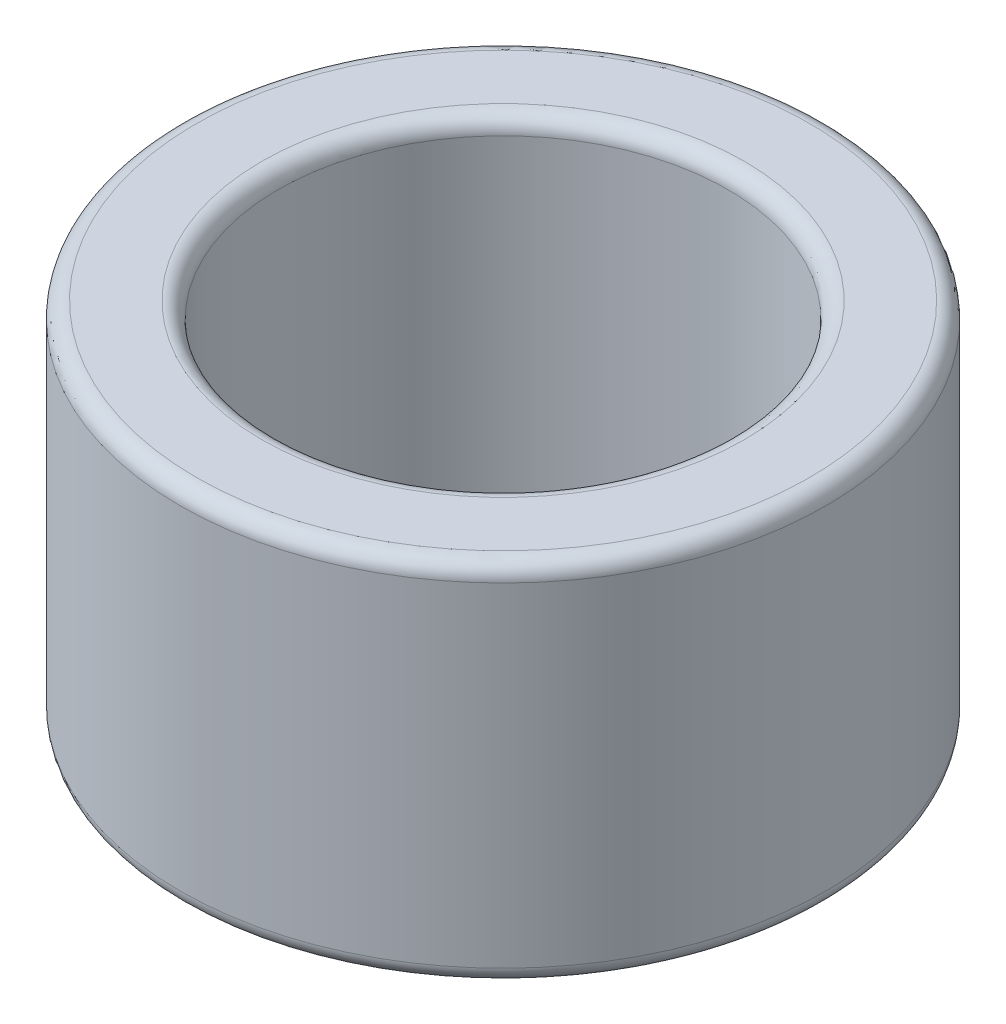
from build123d import *

# Parameters (mm, degrees)
SKETCH1_R                = 3.95
BOSS_EXTRUDE1_DEPTH      = 4.48
M5_CLEARANCE_HOLE1_D     = 5.5
M5_CLEARANCE_HOLE1_DEPTH = 4.48
M5_CLEARANCE_HOLE1_TIP   = 1.652366702
FILLET1_R                = 0.2


with BuildPart() as part:
    # Sketch1 → Boss-Extrude1 (new body)
    with BuildSketch(Plane(origin=(0, 0, 0), x_dir=(1, 0, 0), z_dir=(0, 1, 0))):
        Circle(SKETCH1_R)
    extrude(amount=BOSS_EXTRUDE1_DEPTH)

    # M5 Clearance Hole1
    with Locations(Plane(origin=(0, 4.48, 0), x_dir=(1, 0, 0), z_dir=(0, 1, 0))):
        with Locations((0, 0)):
            Hole(M5_CLEARANCE_HOLE1_D / 2, depth=M5_CLEARANCE_HOLE1_DEPTH)
            with Locations((0, 0, -(M5_CLEARANCE_HOLE1_DEPTH + M5_CLEARANCE_HOLE1_TIP / 2))):  # 118° drill point
                Cone(0, M5_CLEARANCE_HOLE1_D / 2, M5_CLEARANCE_HOLE1_TIP, mode=Mode.SUBTRACT)

    # Fillet1
    fillet1_edges = [part.edges().sort_by_distance(p)[0] for p in [
        (2.75, 0, 0),
        (-3.95, 0, 0),
        (-3.95, 4.48, 0),
        (2.75, 4.48, 0),
    ]]
    fillet(fillet1_edges, radius=FILLET1_R)


solid = part.part
